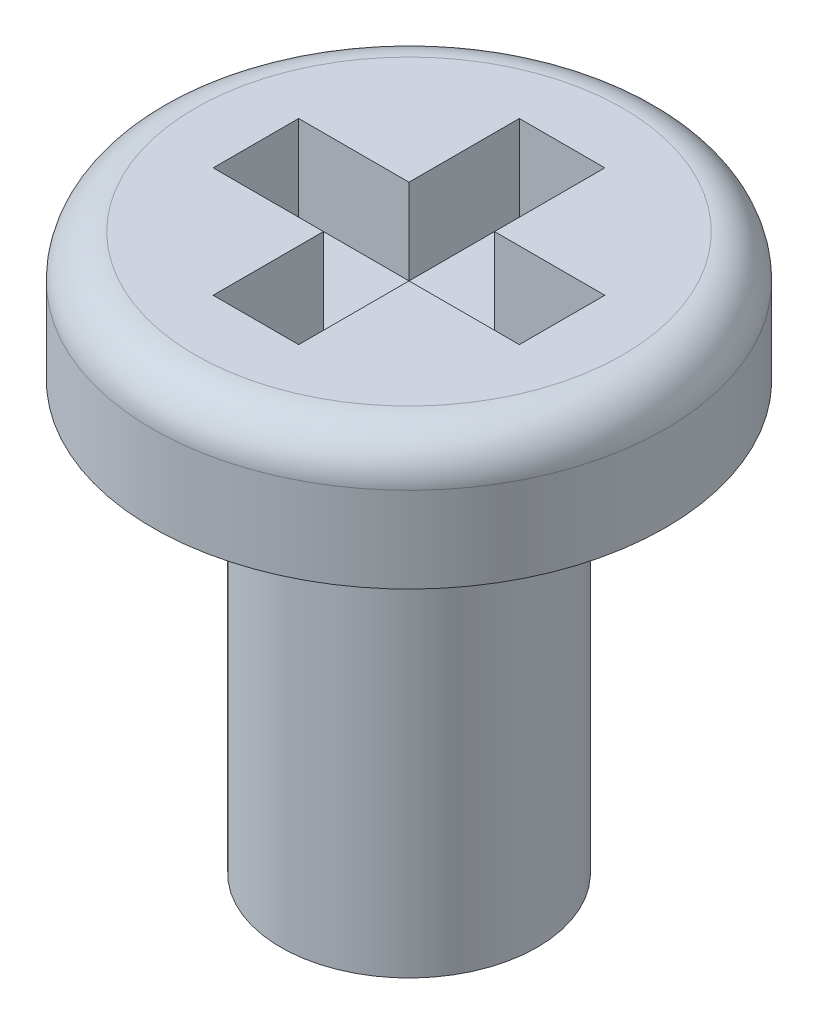
from build123d import *

# Parameters (mm, degrees)
CUT_EXTRUDE2_DEPTH = 1


with BuildPart() as part:
    # Sketch3 → Revolve1 (revolve)
    with BuildSketch(Plane.XY, mode=Mode.PRIVATE) as revolve1_sk:
        with BuildLine():
            Line((-1.5, 1.75), (-1.5, -3.25))
            Line((-1.5, -3.25), (0, -3.25))
            Line((0, -3.25), (0, 3.25))
            Line((0, 3.25), (-2.5, 3.25))
            ThreePointArc((-2.5, 3.25), (-2.853553391, 3.103553391), (-3, 2.75))
            Line((-3, 2.75), (-3, 1.75))
            Line((-3, 1.75), (-1.5, 1.75))
        make_face()
    revolve(revolve1_sk.sketch.rotate(Axis((0, -3.25, 0), (0, 1, 0)), 180), axis=Axis((0, -3.25, 0), (0, 1, 0)))

    # Sketch5 → Cut-Extrude2 (cut)
    with BuildSketch(Plane(origin=(0, 3.25, 0), x_dir=(1, 0, 0), z_dir=(0, 1, 0))):
        Polygon((-0.5, 1.790322581), (0.5, 1.790322581), (0.5, 0.5), (1.790322581, 0.5), (1.790322581, -0.5), (0.5, -0.5), (0.5, -1.790322581), (-0.5, -1.790322581), (-0.5, -0.5), (-1.790322581, -0.5), (-1.790322581, 0.5), (-0.5, 0.5), align=None)
    extrude(amount=-CUT_EXTRUDE2_DEPTH, mode=Mode.SUBTRACT)


solid = part.part
